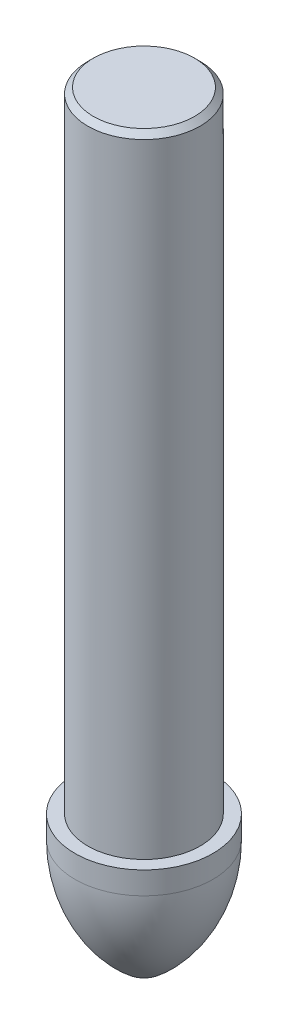
from build123d import *

# Parameters (mm, degrees)
CHAMFER1_SIZE = 0.25


with BuildPart() as part:
    # Sketch1 → Revolve1 (revolve)
    with BuildSketch(Plane.XY, mode=Mode.PRIVATE) as revolve1_sk:
        with BuildLine():
            Line((0, 0), (2.5, 0))
            Line((2.5, 0), (2.5, -28))
            Line((2.5, -28), (3.07, -28))
            Line((3.07, -28), (3.07, -29))
            ThreePointArc((3.07, -29), (2.469307539, -31.648711382), (0.784764826, -33.779161865))
            ThreePointArc((0.784764826, -33.779161865), (0.416115665, -33.984911425), (0, -34.05620546))
            Line((0, -34.05620546), (0, 0))
        make_face()
    revolve(revolve1_sk.sketch.rotate(Axis((0, 0, 0), (0, -1, 0)), 180), axis=Axis((0, 0, 0), (0, -1, 0)))

    # Chamfer1
    chamfer1_edges = [part.edges().sort_by_distance(p)[0] for p in [
        (2.5, 0, 0),
    ]]
    chamfer(chamfer1_edges, length=CHAMFER1_SIZE)


solid = part.part
